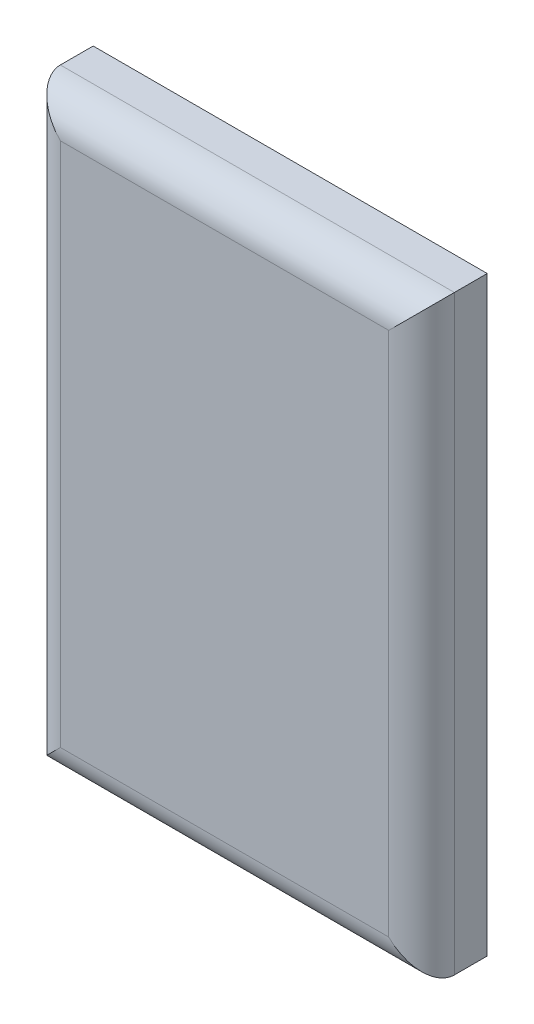
from build123d import *

# Parameters (mm, degrees)
SKETCH1_W           = 152.4
SKETCH1_H           = 228.6
BOSS_EXTRUDE1_DEPTH = 25.4
FILLET1_R           = 12.7


with BuildPart() as part:
    # Sketch1 → Boss-Extrude1 (new body)
    with BuildSketch(Plane.XY):
        Rectangle(SKETCH1_W, SKETCH1_H)
    extrude(amount=BOSS_EXTRUDE1_DEPTH)

    # Fillet1
    fillet1_edges = [part.edges().sort_by_distance(p)[0] for p in [
        (-76.2, 0, 25.4),
        (0, -114.3, 25.4),
        (76.2, 0, 25.4),
        (0, 114.3, 25.4),
    ]]
    fillet(fillet1_edges, radius=FILLET1_R)


solid = part.part
